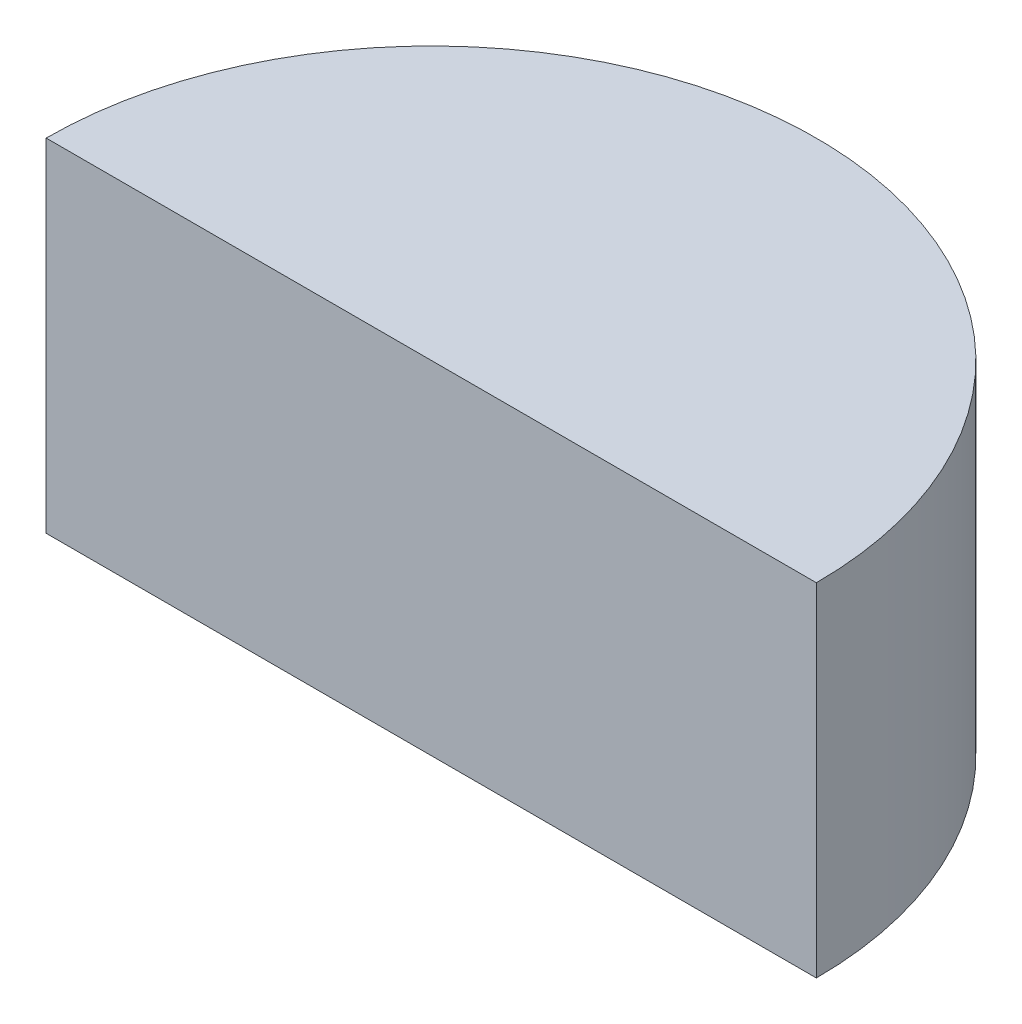
from build123d import *

# Parameters (mm, degrees)
EXTRUDE_1_DEPTH = 2


with BuildPart() as part:
    # 草图1 → 凸台-拉伸1 (new body)
    with BuildSketch(Plane(origin=(0, 0, 0), x_dir=(1, 0, 0), z_dir=(0, 1, 0))):
        with BuildLine():
            Line((-2.25, 0), (2.25, 0))
            ThreePointArc((2.25, 0), (0, 2.25), (-2.25, 0))
        make_face()
    extrude(amount=EXTRUDE_1_DEPTH)


solid = part.part
